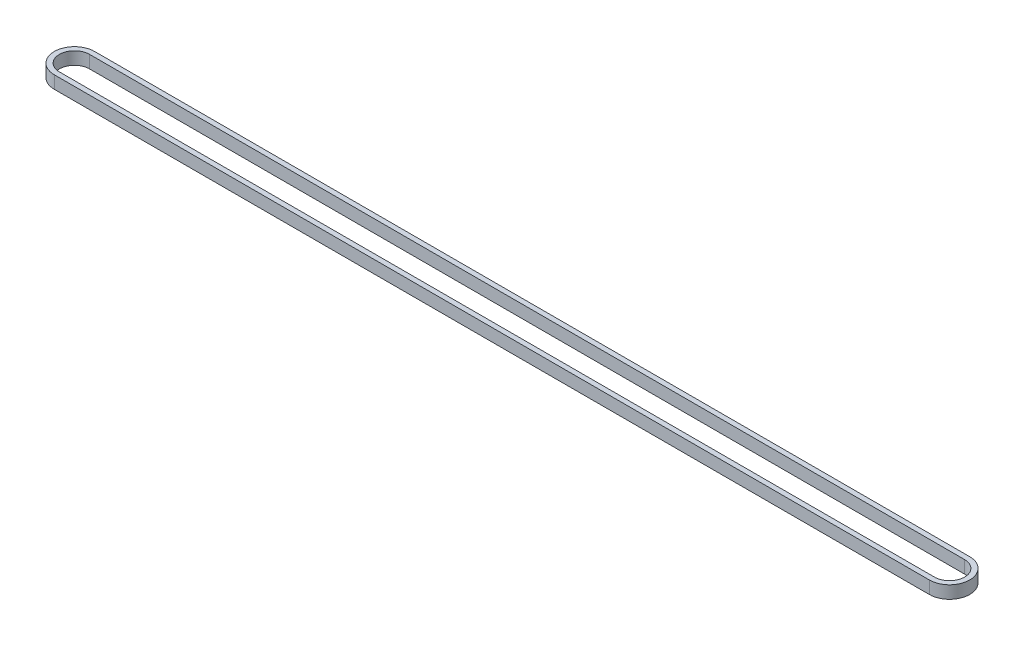
from build123d import *

# Parameters (mm, degrees)
BOSS_EXTRUDE1_DEPTH = 5


with BuildPart() as part:
    # Sketch2 → Boss-Extrude1 (new body)
    with BuildSketch(Plane(origin=(0, 0, 0), x_dir=(1, 0, 0), z_dir=(0, 1, 0))):
        with BuildLine():
            Line((39.267874126, 73.022465677), (386.267874126, 73.022465677))
            ThreePointArc((386.267874126, 73.022465677), (394.267874126, 65.022465677), (386.267874126, 57.022465677))
            Line((386.267874126, 57.022465677), (39.267874126, 57.022465677))
            ThreePointArc((39.267874126, 57.022465677), (31.267874126, 65.022465677), (39.267874126, 73.022465677))
        make_face()
        with BuildLine():
            Line((39.267874126, 71.022465677), (386.267874126, 71.022465677))
            ThreePointArc((386.267874126, 71.022465677), (392.267874126, 65.022465677), (386.267874126, 59.022465677))
            Line((386.267874126, 59.022465677), (39.267874126, 59.022465677))
            ThreePointArc((39.267874126, 59.022465677), (33.267874126, 65.022465677), (39.267874126, 71.022465677))
        make_face(mode=Mode.SUBTRACT)
    extrude(amount=BOSS_EXTRUDE1_DEPTH)


solid = part.part
